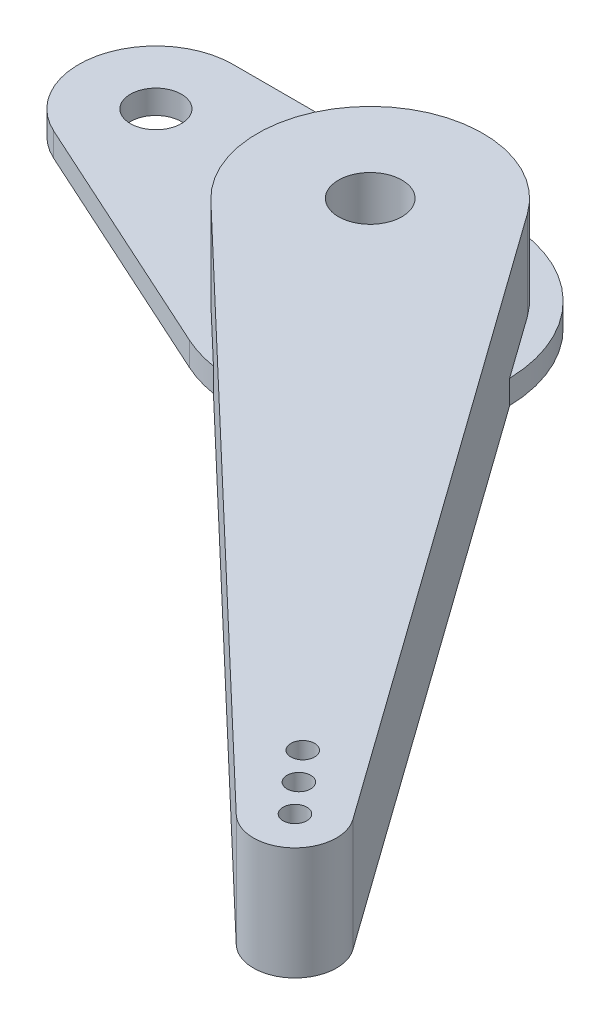
from build123d import *

# Parameters (mm, degrees)
ESQUISSE1_R             = 2.675
ESQUISSE1_R_2           = 2.15
BOSS_EXTRU_1_DEPTH      = 2
BOSS_EXTRU_2_DEPTH      = 7.5
BOSS_EXTRU_2_DEPTH_BACK = 2
ESQUISSE2_R             = 2.675
ESQUISSE2_R_2           = 1


with BuildPart() as part:
    # Esquisse1 → Boss.-Extru.1 (new body)
    with BuildSketch(Plane(origin=(0, 0, 0), x_dir=(1, 0, 0), z_dir=(0, 1, 0))):
        with BuildLine():
            Line((0, 11.5), (-23.064258063, 11.5))
            ThreePointArc((-23.064258063, 11.5), (-29.416702021, 6.377118644), (-25.755971605, -0.916475151))
            Line((-25.755971605, -0.916475151), (-4.76226242, -10.467609882))
            ThreePointArc((-4.76226242, -10.467609882), (11.23893931, -2.436440678), (0, 11.5))
        make_face()
        with Locations(Location((0, 0, 0), (0, 0, 270))):
            Circle(ESQUISSE1_R, mode=Mode.SUBTRACT)
        with Locations(Location((-23.064258063, 5, 0), (0, 0, 270))):
            Circle(ESQUISSE1_R_2, mode=Mode.SUBTRACT)
    extrude(amount=BOSS_EXTRU_1_DEPTH)

    # Esquisse2 → Boss.-Extru.2 (add, two sides: drawn at the far end of the back side and taken through both)
    with BuildSketch(Plane(origin=(0, 2, 0), x_dir=(1, 0, 0), z_dir=(0, 1, 0)).offset(-BOSS_EXTRU_2_DEPTH_BACK)):
        with BuildLine():
            Line((7.728498539, 5.524519013), (44.604848398, -46.063468165))
            ThreePointArc((44.604848398, -46.063468165), (44.052017955, -50.741773707), (39.342439126, -50.632085515))
            Line((39.342439126, -50.632085515), (-6.555183772, -6.876013796))
            ThreePointArc((-6.555183772, -6.876013796), (-6.227958764, 7.173738888), (7.728498539, 5.524519013))
        make_face()
        with Locations(Location((0, 0, 0), (0, 0, 270))):
            Circle(ESQUISSE2_R, mode=Mode.SUBTRACT)
        with Locations(Location((41.757506831, -48.098817275, 0), (0, 0, 270))):
            Circle(ESQUISSE2_R_2, mode=Mode.SUBTRACT)
        with Locations(Location((39.594110629, -45.606886924, 0), (0, 0, 270))):
            Circle(ESQUISSE2_R_2, mode=Mode.SUBTRACT)
        with Locations(Location((37.430714426, -43.114956574, 0), (0, 0, 270))):
            Circle(ESQUISSE2_R_2, mode=Mode.SUBTRACT)
    extrude(amount=BOSS_EXTRU_2_DEPTH + BOSS_EXTRU_2_DEPTH_BACK)


solid = part.part
